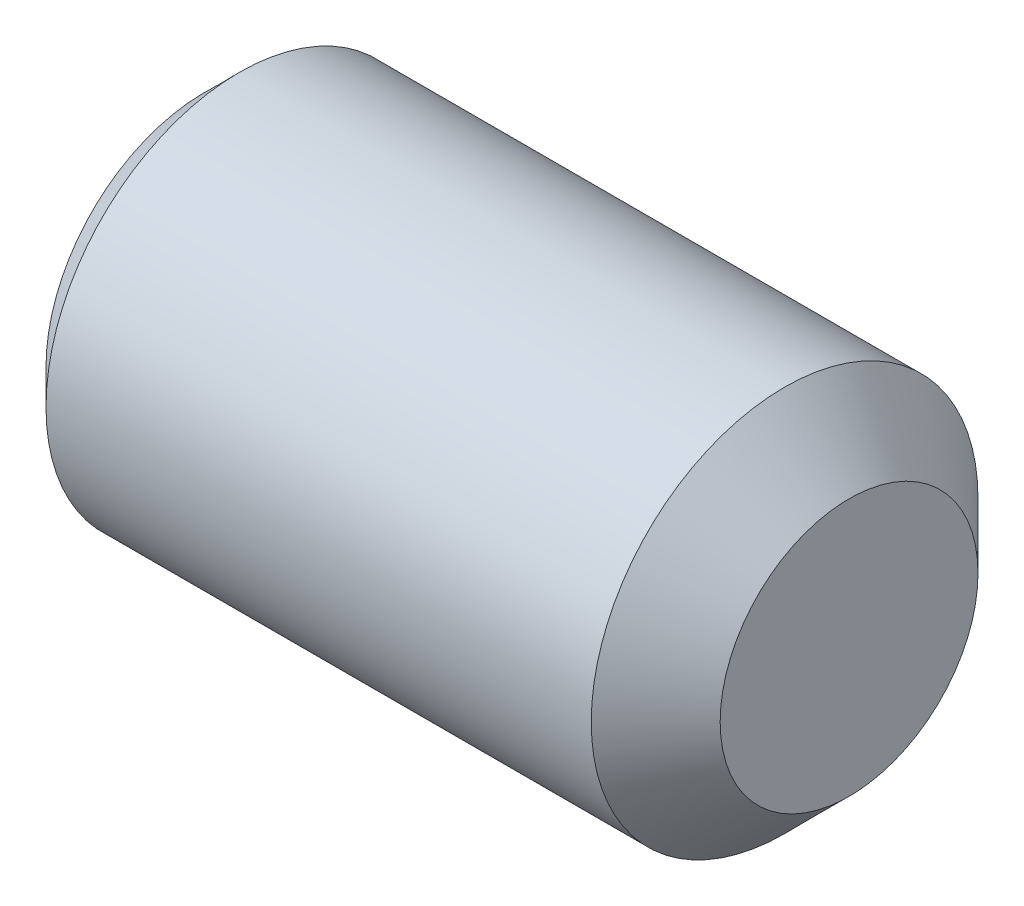
from build123d import *

# Parameters (mm, degrees)
SKETCH1_W          = 5
SKETCH1_H          = 1.5
CUT_EXTRUDE1_DEPTH = 1.2
CHAMFER1_SIZE      = 0.270625
CHAMFER2_SIZE      = 0.5


with BuildPart() as part:
    # Sketch1 → Revolve1 (revolve)
    with BuildSketch(Plane(origin=(0, 0, 0), x_dir=(-1, 0, 0), z_dir=(0, 0, -1)), mode=Mode.PRIVATE) as revolve1_sk:
        with Locations((-2.5, 0.75)):
            Rectangle(SKETCH1_W, SKETCH1_H)
    revolve(revolve1_sk.sketch.rotate(Axis((5, 0, 0), (-1, 0, 0)), 270), axis=Axis((5, 0, 0), (-1, 0, 0)))

    # Sketch2 → Cut-Extrude1 (cut)
    with BuildSketch(Plane.ZY):
        Polygon((-0.75, -0.433012702), (0, -0.866025404), (0.75, -0.433012702), (0.75, 0.433012702), (0, 0.866025404), (-0.75, 0.433012702), align=None)
    extrude(amount=-CUT_EXTRUDE1_DEPTH, mode=Mode.SUBTRACT)

    # Chamfer1
    chamfer1_edges = [part.edges().sort_by_distance(p)[0] for p in [
        (0, 0, -1.5),
    ]]
    chamfer(chamfer1_edges, length=CHAMFER1_SIZE)

    # Chamfer2
    chamfer2_edges = [part.edges().sort_by_distance(p)[0] for p in [
        (5, 0, -1.5),
    ]]
    chamfer(chamfer2_edges, length=CHAMFER2_SIZE)


solid = part.part
